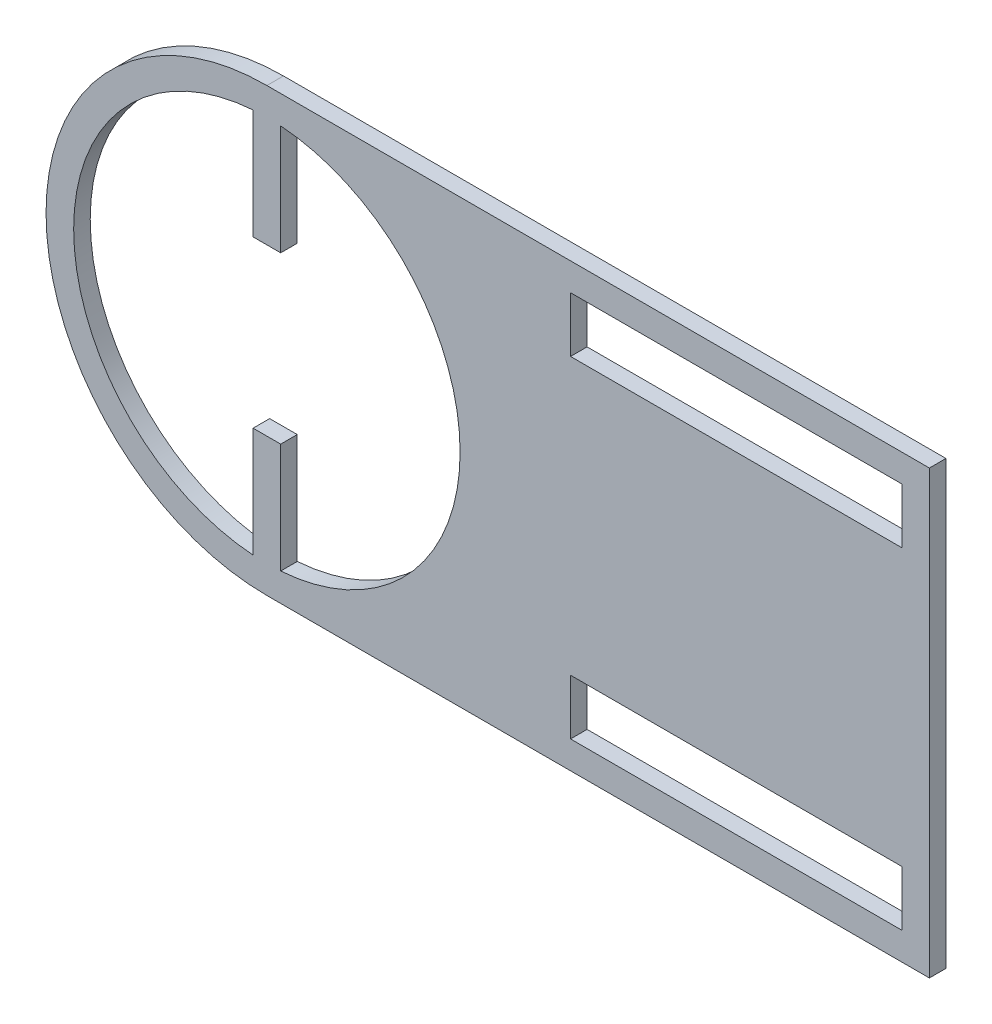
from build123d import *

# Parameters (mm, degrees)
SKETCH1_W           = 60
SKETCH1_H           = 10
BOSS_EXTRUDE1_DEPTH = 3


with BuildPart() as part:
    # Sketch1 → Boss-Extrude1 (new body)
    with BuildSketch(Plane.XY):
        with BuildLine():
            Line((0, 0), (120, 0))
            Line((120, 0), (120, 80))
            Line((120, 80), (0, 80))
            ThreePointArc((0, 80), (-40, 40), (0, 0))
        make_face()
        with Locations((85, 70)):
            Rectangle(SKETCH1_W, SKETCH1_H, mode=Mode.SUBTRACT)
        with Locations((85, 10)):
            Rectangle(SKETCH1_W, SKETCH1_H, mode=Mode.SUBTRACT)
        with BuildLine():
            Line((2.5, 55), (2.5, 74.910600109))
            ThreePointArc((2.5, 74.910600109), (35, 40), (2.5, 5.089399891))
            Line((2.5, 5.089399891), (2.5, 25))
            Line((2.5, 25), (-2.5, 25))
            Line((-2.5, 25), (-2.5, 5.089399891))
            ThreePointArc((-2.5, 5.089399891), (-35, 40), (-2.5, 74.910600109))
            Line((-2.5, 74.910600109), (-2.5, 55))
            Line((-2.5, 55), (2.5, 55))
        make_face(mode=Mode.SUBTRACT)
    extrude(amount=BOSS_EXTRUDE1_DEPTH)


solid = part.part
